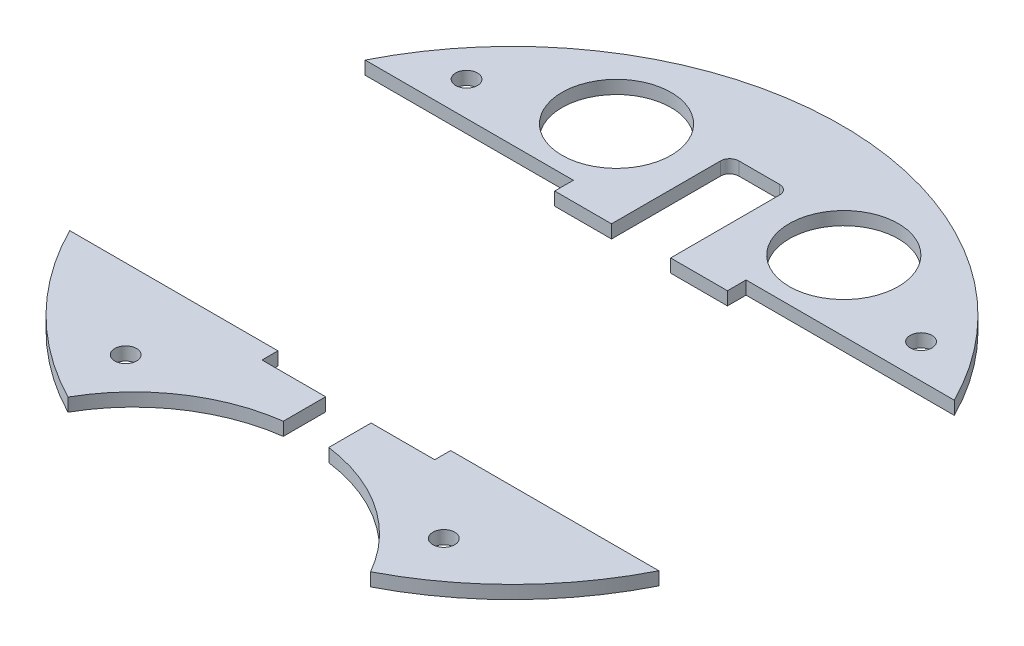
from build123d import *

# Parameters (mm, degrees)
BOSS_EXTRUDE1_DEPTH     = 2.9
SOLENOID_PLACEMENT_W    = 38
SOLENOID_PLACEMENT_H    = 64.4
CUT_EXTRUDE1_DEPTH      = 103.571487266
CUT_EXTRUDE4_DEPTH      = 103.571487266
SKETCH5_R               = 12
CUT_EXTRUDE5_DEPTH      = 103.571487266
SKETCH6_R               = 2.4
CUT_EXTRUDE6_DEPTH      = 103.571487266
CUT_EXTRUDE3_DEPTH      = 103.571487266
CUT_EXTRUDE9_DEPTH      = 98.286484159
CUT_EXTRUDE9_DEPTH_BACK = 98.286484159
SKETCH8_W               = 10
SKETCH8_H               = 62.80248699


with BuildPart() as part:
    # Sketch1 → Boss-Extrude1 (new body)
    with BuildSketch(Plane(origin=(0, 0, 0), x_dir=(1, 0, 0), z_dir=(0, 1, 0))):
        with BuildLine():
            ThreePointArc((33.29110537, -64.404598464), (0, 72.5), (-33.29110537, -64.404598464))
            ThreePointArc((-33.29110537, -64.404598464), (0, -44.989799638), (33.29110537, -64.404598464))
        make_face()
    extrude(amount=BOSS_EXTRUDE1_DEPTH)

    # solenoid placement → Cut-Extrude1 (cut, through all)
    with BuildSketch(Plane(origin=(0, 2.9, 0), x_dir=(1, 0, 0), z_dir=(0, 1, 0))):
        with Locations((0, -3.8)):
            Rectangle(SOLENOID_PLACEMENT_W, SOLENOID_PLACEMENT_H)
    extrude(amount=-CUT_EXTRUDE1_DEPTH, mode=Mode.SUBTRACT)

    # Sketch4 → Cut-Extrude4 (cut, through all)
    with BuildSketch(Plane(origin=(0, 2.9, 0), x_dir=(1, 0, 0), z_dir=(0, 1, 0))):
        with BuildLine():
            Line((-6.5, 28.1), (6.5, 28.1))
            Line((6.5, 28.1), (6.5, 52.4))
            ThreePointArc((6.5, 52.4), (5.914213562, 53.814213562), (4.5, 54.4))
            Line((4.5, 54.4), (-4.5, 54.4))
            ThreePointArc((-4.5, 54.4), (-5.914213562, 53.814213562), (-6.5, 52.4))
            Line((-6.5, 52.4), (-6.5, 28.1))
        make_face()
    extrude(amount=-CUT_EXTRUDE4_DEPTH, mode=Mode.SUBTRACT)

    # Sketch5 → Cut-Extrude5 (cut, through all)
    with BuildSketch(Plane(origin=(0, 2.9, 0), x_dir=(1, 0, 0), z_dir=(0, 1, 0))):
        with Locations(Location((-25, 48, 0), (0, 0, 270))):
            Circle(SKETCH5_R)
        with Locations(Location((25, 48, 0), (0, 0, 270))):
            Circle(SKETCH5_R)
    extrude(amount=-CUT_EXTRUDE5_DEPTH, mode=Mode.SUBTRACT)

    # Sketch6 → Cut-Extrude6 (cut, through all)
    with BuildSketch(Plane(origin=(0, 2.9, 0), x_dir=(1, 0, 0), z_dir=(0, 1, 0))):
        with Locations(Location((35, -50, 0), (0, 0, 270))):
            Circle(SKETCH6_R)
        with Locations(Location((-35, -50, 0), (0, 0, 270))):
            Circle(SKETCH6_R)
        with Locations(Location((-50, 40, 0), (0, 0, 270))):
            Circle(SKETCH6_R)
        with Locations(Location((50, 40, 0), (0, 0, 270))):
            Circle(SKETCH6_R)
    extrude(amount=-CUT_EXTRUDE6_DEPTH, mode=Mode.SUBTRACT)

    # Sketch3 → Cut-Extrude3 (cut, through all)
    with BuildSketch(Plane(origin=(0, 2.9, 0), x_dir=(1, 0, 0), z_dir=(0, 1, 0))):
        Polygon((-19, 28.4), (19, 28.4), (19, 32.5), (72.5, 32.5), (72.5, -32.5), (-72.5, -32.5), (-72.5, 32.5), (-19, 32.5), align=None)
    extrude(amount=-CUT_EXTRUDE3_DEPTH, mode=Mode.SUBTRACT)


with BuildPart() as cut_extrude3_piece_1:
    # of the separate pieces the step leaves, piece 1, a body of its own (cut_extrude3_pieces)
    add(part.part.solids().sort_by_distance((64.807406984, 0, -32.5))[0])


with BuildPart() as cut_extrude3_piece_2:
    # of the separate pieces the step leaves, piece 2, a body of its own (cut_extrude3_pieces)
    add(part.part.solids().sort_by_distance((-33.29110537, 0, 64.404598464))[0])

    # Sketch8 → Cut-Extrude9 (cut, two sides: drawn at the far end of the back side and taken through both)
    with BuildSketch(Plane(origin=(0, 2.9, 0), x_dir=(1, 0, 0), z_dir=(0, 1, 0)).offset(-CUT_EXTRUDE9_DEPTH_BACK)):
        with Locations((0, -31.401243495)):
            Rectangle(SKETCH8_W, SKETCH8_H)
    extrude(amount=CUT_EXTRUDE9_DEPTH + CUT_EXTRUDE9_DEPTH_BACK, mode=Mode.SUBTRACT)


with BuildPart() as cut_extrude9_piece_1:
    # of the separate pieces the step leaves, piece 1, a body of its own (cut_extrude9_pieces)
    add(cut_extrude3_piece_2.part.solids().sort_by_distance((-33.29110537, 0, 64.404598464))[0])


with BuildPart() as cut_extrude9_piece_2:
    # of the separate pieces the step leaves, piece 2, a body of its own (cut_extrude9_pieces)
    add(cut_extrude3_piece_2.part.solids().sort_by_distance((5, 0, 45.318005113))[0])


solid = Compound([cut_extrude3_piece_1.part, cut_extrude9_piece_1.part, cut_extrude9_piece_2.part])
